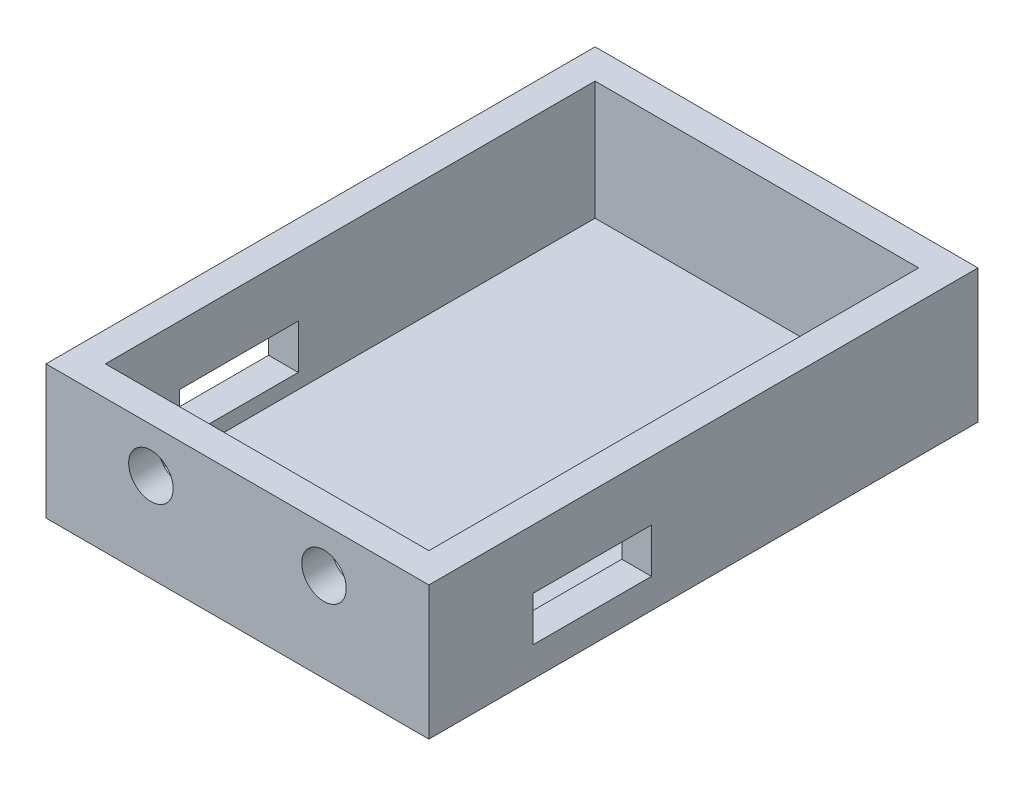
from build123d import *

# Parameters (mm, degrees)
SKETCH1_W           = 25.8
SKETCH1_H           = 37
SKETCH1_W_2         = 21.8
SKETCH1_H_2         = 33
BOSS_EXTRUDE2_DEPTH = 1
BOSS_EXTRUDE3_DEPTH = 3
SKETCH4_W           = 25.8
SKETCH4_H           = 37
BOSS_EXTRUDE4_DEPTH = 1
SKETCH5_W           = 25.8
SKETCH5_H           = 37
SKETCH5_W_2         = 21.8
SKETCH5_H_2         = 33
BOSS_EXTRUDE5_DEPTH = 4
SKETCH6_R           = 1.5
CUT_EXTRUDE1_DEPTH  = 4


with BuildPart() as part:
    # Sketch1 → Boss-Extrude2 (new body)
    with BuildSketch(Plane(origin=(0, 0, 0), x_dir=(1, 0, 0), z_dir=(0, 1, 0))):
        Rectangle(SKETCH1_W, SKETCH1_H)
        Rectangle(SKETCH1_W_2, SKETCH1_H_2, mode=Mode.SUBTRACT)
    extrude(amount=BOSS_EXTRUDE2_DEPTH)

    # Sketch3 → Boss-Extrude3 (add)
    with BuildSketch(Plane(origin=(0, 1, 0), x_dir=(1, 0, 0), z_dir=(0, 1, 0))):
        Polygon((-12.9, -11.5), (-12.9, -18.5), (12.9, -18.5), (12.9, -11.5), (10.9, -11.5), (10.9, -16.5), (-10.9, -16.5), (-10.9, -11.5), align=None)
        Polygon((-12.9, 18.5), (-12.9, -3.5), (-10.9, -3.5), (-10.9, 16.5), (10.9, 16.5), (10.9, -3.5), (12.9, -3.5), (12.9, 18.5), align=None)
    extrude(amount=BOSS_EXTRUDE3_DEPTH)

    # Sketch4 → Boss-Extrude4 (add)
    with BuildSketch(Plane.XZ):
        Rectangle(SKETCH4_W, SKETCH4_H)
    extrude(amount=BOSS_EXTRUDE4_DEPTH)

    # Sketch5 → Boss-Extrude5 (add)
    with BuildSketch(Plane(origin=(0, 4, 0), x_dir=(1, 0, 0), z_dir=(0, 1, 0))):
        Rectangle(SKETCH5_W, SKETCH5_H)
        Rectangle(SKETCH5_W_2, SKETCH5_H_2, mode=Mode.SUBTRACT)
    extrude(amount=BOSS_EXTRUDE5_DEPTH)

    # Sketch6 → Cut-Extrude1 (cut)
    with BuildSketch(Plane.XY.offset(18.5)):
        with Locations((-5.830929934, 5)):
            Circle(SKETCH6_R)
        with Locations(Location((5.830929934, 5, 0), (0, 0, 180))):
            Circle(SKETCH6_R)
    extrude(amount=-CUT_EXTRUDE1_DEPTH, mode=Mode.SUBTRACT)


solid = part.part
